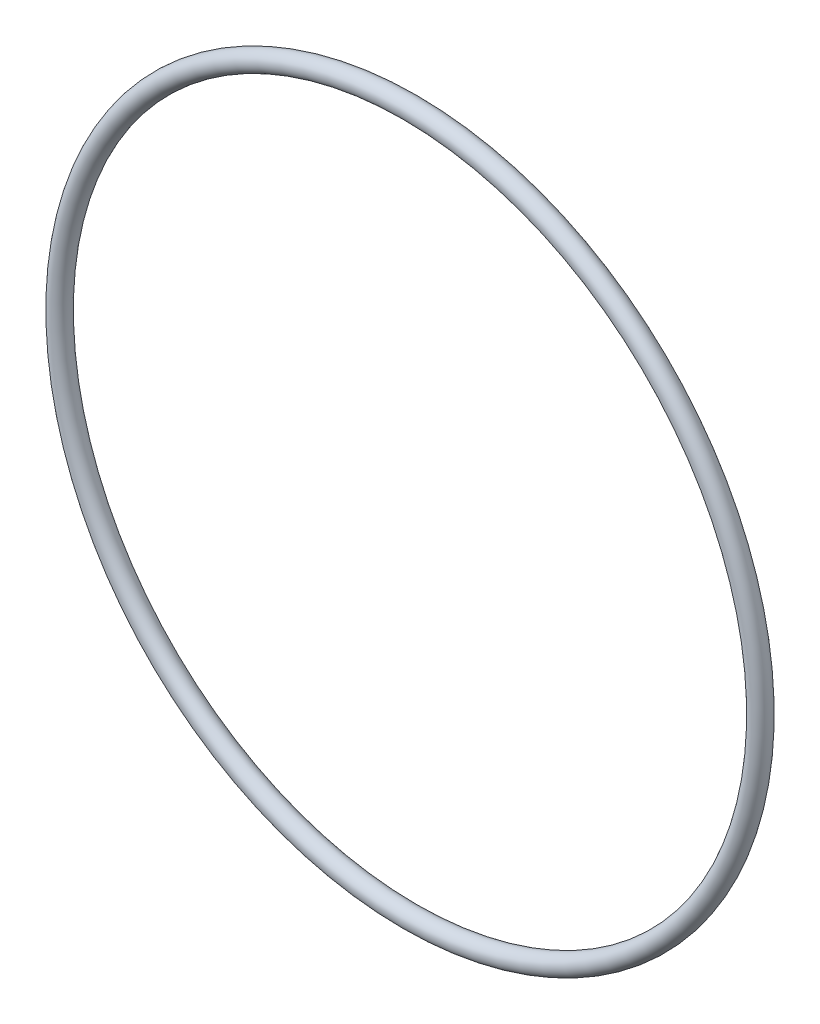
from build123d import *

# Parameters (mm, degrees)
SKETCH2_R = 1.7653


with BuildPart() as part:
    # Sketch2 → Revolve1 (revolve)
    with BuildSketch(Plane(origin=(0, 0, 0), x_dir=(0, 0, -1), z_dir=(1, 0, 0)), mode=Mode.PRIVATE) as revolve1_sk:
        with Locations((0, 63.4746)):
            Circle(SKETCH2_R)
    revolve(revolve1_sk.sketch.rotate(Axis((0, 0, 61.7093), (0, 0, -1)), 180), axis=Axis((0, 0, 61.7093), (0, 0, -1)))


solid = part.part
